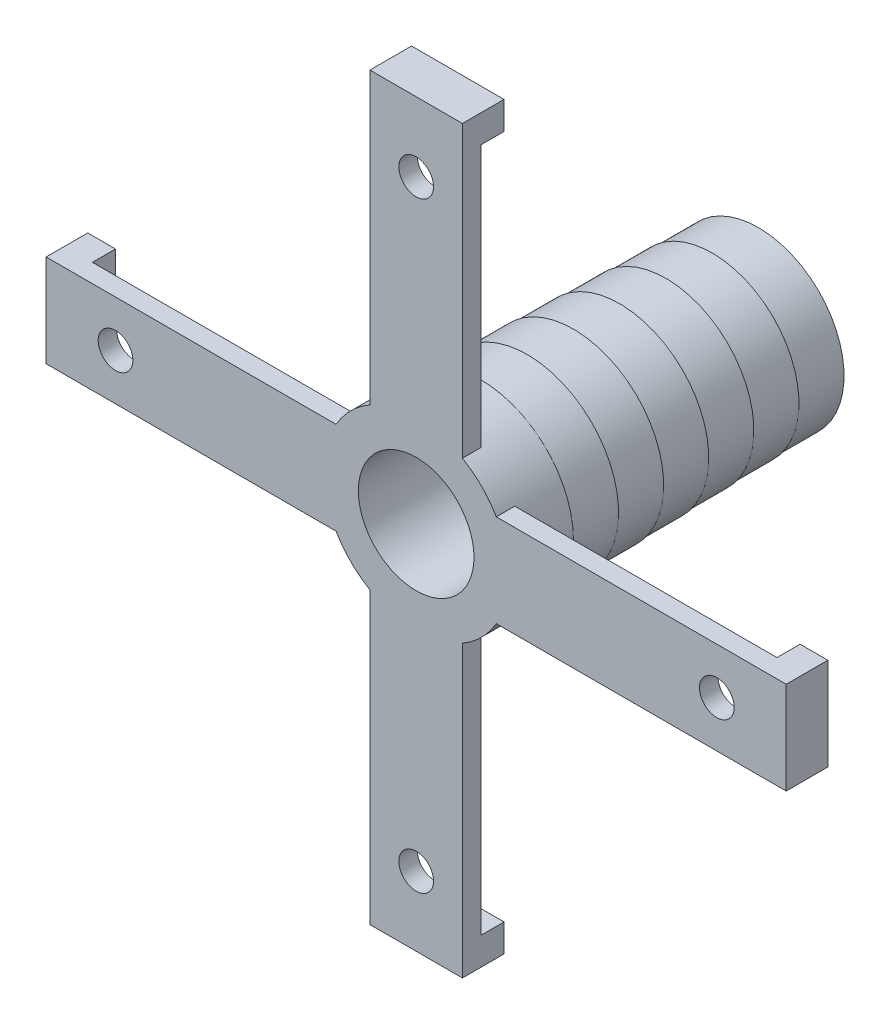
from build123d import *

# Parameters (mm, degrees)
SKETCH1_R               = 10
BOSS_EXTRUDE1_DEPTH     = 5
SKETCH2_W               = 5
SKETCH2_H               = 5
BOSS_EXTRUDE2_DEPTH     = 2
SKETCH3_R               = 9.875
BOSS_EXTRUDE3_DEPTH     = 5
SKETCH4_R               = 9.75
BOSS_EXTRUDE4_DEPTH     = 5
SKETCH5_R               = 9.625
BOSS_EXTRUDE5_DEPTH     = 5
SKETCH6_R               = 9.5
BOSS_EXTRUDE6_DEPTH     = 5
SKETCH7_R               = 9.375
BOSS_EXTRUDE7_DEPTH     = 5
SKETCH8_R               = 9.25
BOSS_EXTRUDE8_DEPTH     = 5
SKETCH9_W               = 3
SKETCH9_H               = 10
SKETCH9_W_2             = 10
SKETCH9_H_2             = 3
BOSS_EXTRUDE9_DEPTH     = 2.5
CUT_EXTRUDE1_DEPTH      = 67.520673478
CUT_EXTRUDE1_DEPTH_BACK = 67.520673478
SKETCH10_R              = 1.875
CUT_EXTRUDE2_DEPTH      = 68.594378464
CUT_EXTRUDE2_DEPTH_BACK = 68.594378464
SKETCH11_R              = 6.25


with BuildPart() as part:
    # Sketch1 → Boss-Extrude1 (new body)
    with BuildSketch(Plane.XY):
        Circle(SKETCH1_R)
    extrude(amount=BOSS_EXTRUDE1_DEPTH)

    # Sketch2 → Boss-Extrude2 (add)
    with BuildSketch(Plane.XY.offset(5)):
        with BuildLine():
            ThreePointArc((-8.660254038, -5), (-10, 0), (-8.660254038, 5))
            Line((-8.660254038, 5), (-40, 5))
            Line((-40, 5), (-40, -5))
            Line((-40, -5), (-8.660254038, -5))
        make_face()
        with BuildLine():
            Line((-5, 0), (-5, 5))
            Line((-5, 5), (-8.660254038, 5))
            ThreePointArc((-8.660254038, 5), (-10, 0), (-8.660254038, -5))
            Line((-8.660254038, -5), (-5, -5))
            Line((-5, -5), (-5, 0))
        make_face()
        with BuildLine():
            Line((-5, 40), (-5, 8.660254038))
            ThreePointArc((-5, 8.660254038), (0, 10), (5, 8.660254038))
            Line((5, 8.660254038), (5, 40))
            Line((5, 40), (-5, 40))
        make_face()
        with BuildLine():
            Line((-5, 5), (0, 5))
            Line((0, 5), (5, 5))
            Line((5, 5), (5, 8.660254038))
            ThreePointArc((5, 8.660254038), (0, 10), (-5, 8.660254038))
            Line((-5, 8.660254038), (-5, 5))
        make_face()
        with BuildLine():
            Line((40, 5), (8.660254038, 5))
            ThreePointArc((8.660254038, 5), (9.659258263, 2.588190451), (10, 0))
            ThreePointArc((10, 0), (9.659258263, -2.588190451), (8.660254038, -5))
            Line((8.660254038, -5), (40, -5))
            Line((40, -5), (40, 5))
        make_face()
        with BuildLine():
            Line((8.660254038, 5), (5, 5))
            Line((5, 5), (5, 0))
            Line((5, 0), (5, -5))
            Line((5, -5), (8.660254038, -5))
            ThreePointArc((8.660254038, -5), (9.659258263, -2.588190451), (10, 0))
            ThreePointArc((10, 0), (9.659258263, 2.588190451), (8.660254038, 5))
        make_face()
        with BuildLine():
            ThreePointArc((5, -8.660254038), (0, -10), (-5, -8.660254038))
            Line((-5, -8.660254038), (-5, -40))
            Line((-5, -40), (5, -40))
            Line((5, -40), (5, -8.660254038))
        make_face()
        with BuildLine():
            Line((5, -5), (0, -5))
            Line((0, -5), (-5, -5))
            Line((-5, -5), (-5, -8.660254038))
            ThreePointArc((-5, -8.660254038), (0, -10), (5, -8.660254038))
            Line((5, -8.660254038), (5, -5))
        make_face()
        with Locations((2.5, -2.5)):
            Rectangle(SKETCH2_W, SKETCH2_H)
        with Locations((-2.5, -2.5)):
            Rectangle(SKETCH2_W, SKETCH2_H)
        with Locations((2.5, 2.5)):
            Rectangle(SKETCH2_W, SKETCH2_H)
        with Locations((-2.5, 2.5)):
            Rectangle(SKETCH2_W, SKETCH2_H)
        with BuildLine():
            Line((-8.660254038, 5), (-5, 5))
            Line((-5, 5), (-5, 8.660254038))
            ThreePointArc((-5, 8.660254038), (-7.071067812, 7.071067812), (-8.660254038, 5))
        make_face()
        with BuildLine():
            Line((5, 8.660254038), (5, 5))
            Line((5, 5), (8.660254038, 5))
            ThreePointArc((8.660254038, 5), (7.071067812, 7.071067812), (5, 8.660254038))
        make_face()
        with BuildLine():
            Line((8.660254038, -5), (5, -5))
            Line((5, -5), (5, -8.660254038))
            ThreePointArc((5, -8.660254038), (7.071067812, -7.071067812), (8.660254038, -5))
        make_face()
        with BuildLine():
            Line((-5, -5), (-8.660254038, -5))
            ThreePointArc((-8.660254038, -5), (-7.071067812, -7.071067812), (-5, -8.660254038))
            Line((-5, -8.660254038), (-5, -5))
        make_face()
    extrude(amount=BOSS_EXTRUDE2_DEPTH)

    # Sketch3 → Boss-Extrude3 (add)
    with BuildSketch(Plane(origin=(0, 0, 0), x_dir=(-1, 0, 0), z_dir=(0, 0, -1))):
        Circle(SKETCH3_R)
    extrude(amount=BOSS_EXTRUDE3_DEPTH)

    # Sketch4 → Boss-Extrude4 (add)
    with BuildSketch(Plane(origin=(0, 0, -5), x_dir=(-1, 0, 0), z_dir=(0, 0, -1))):
        Circle(SKETCH4_R)
    extrude(amount=BOSS_EXTRUDE4_DEPTH)

    # Sketch5 → Boss-Extrude5 (add)
    with BuildSketch(Plane(origin=(0, 0, -10), x_dir=(-1, 0, 0), z_dir=(0, 0, -1))):
        Circle(SKETCH5_R)
    extrude(amount=BOSS_EXTRUDE5_DEPTH)

    # Sketch6 → Boss-Extrude6 (add)
    with BuildSketch(Plane(origin=(0, 0, -15), x_dir=(-1, 0, 0), z_dir=(0, 0, -1))):
        Circle(SKETCH6_R)
    extrude(amount=BOSS_EXTRUDE6_DEPTH)

    # Sketch7 → Boss-Extrude7 (add)
    with BuildSketch(Plane(origin=(0, 0, -20), x_dir=(-1, 0, 0), z_dir=(0, 0, -1))):
        Circle(SKETCH7_R)
    extrude(amount=BOSS_EXTRUDE7_DEPTH)

    # Sketch8 → Boss-Extrude8 (add)
    with BuildSketch(Plane(origin=(0, 0, -25), x_dir=(-1, 0, 0), z_dir=(0, 0, -1))):
        Circle(SKETCH8_R)
    extrude(amount=BOSS_EXTRUDE8_DEPTH)

    # Sketch9 → Boss-Extrude9 (add)
    with BuildSketch(Plane(origin=(0, 0, 5), x_dir=(-1, 0, 0), z_dir=(0, 0, -1))):
        with Locations((-38.5, 0)):
            Rectangle(SKETCH9_W, SKETCH9_H)
        with Locations((0, 38.5)):
            Rectangle(SKETCH9_W_2, SKETCH9_H_2)
        with Locations((38.5, 0)):
            Rectangle(SKETCH9_W, SKETCH9_H)
        with Locations((0, -38.5)):
            Rectangle(SKETCH9_W_2, SKETCH9_H_2)
    extrude(amount=BOSS_EXTRUDE9_DEPTH)

    # Sketch10 → Cut-Extrude1 (cut, two sides: drawn at the far end of the back side and taken through both)
    with BuildSketch(Plane(origin=(0, 0, 5), x_dir=(-1, 0, 0), z_dir=(0, 0, -1)).offset(-CUT_EXTRUDE1_DEPTH_BACK)):
        with Locations((-32.5, 0)):
            Circle(SKETCH10_R)
        with Locations((0, 32.5)):
            Circle(SKETCH10_R)
        with Locations((32.5, 0)):
            Circle(SKETCH10_R)
        with Locations((0, -32.5)):
            Circle(SKETCH10_R)
    extrude(amount=CUT_EXTRUDE1_DEPTH + CUT_EXTRUDE1_DEPTH_BACK, mode=Mode.SUBTRACT)

    # Sketch11 → Cut-Extrude2 (cut, two sides: drawn at the far end of the back side and taken through both)
    with BuildSketch(Plane(origin=(0, 0, -30), x_dir=(-1, 0, 0), z_dir=(0, 0, -1)).offset(-CUT_EXTRUDE2_DEPTH_BACK)):
        Circle(SKETCH11_R)
    extrude(amount=CUT_EXTRUDE2_DEPTH + CUT_EXTRUDE2_DEPTH_BACK, mode=Mode.SUBTRACT)


solid = part.part
